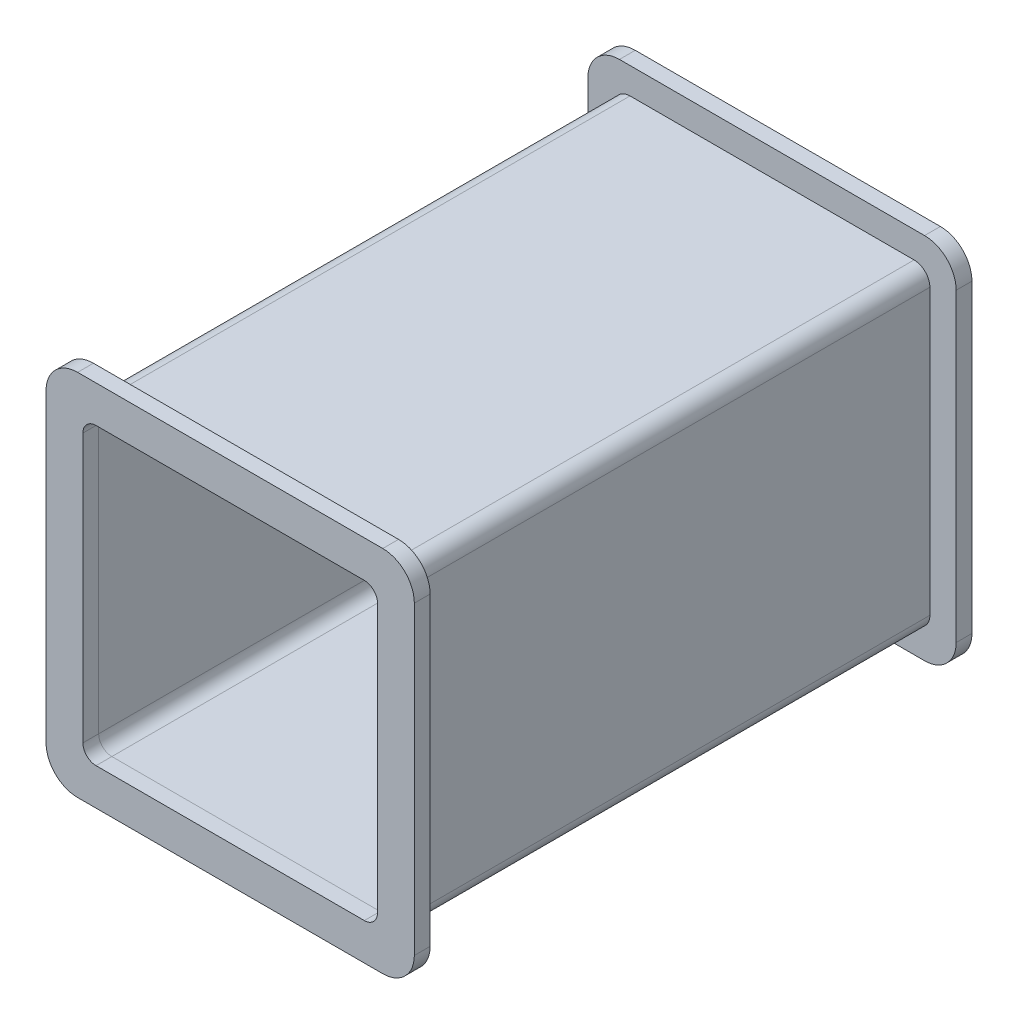
from build123d import *

# Parameters (mm, degrees)
BOSS_EXTRUDE1_DEPTH = 3
BOSS_EXTRUDE2_DEPTH = 100
BOSS_EXTRUDE3_DEPTH = 3


with BuildPart() as part:
    # Sketch1 → Boss-Extrude1 (new body)
    with BuildSketch(Plane(origin=(0, 0, 0), x_dir=(0, 1, 0), z_dir=(0, 0, 1))):
        with BuildLine():
            Line((-1, 63), (57, 63))
            ThreePointArc((57, 63), (61.242640687, 61.242640687), (63, 57))
            Line((63, 57), (63, -1))
            ThreePointArc((63, -1), (61.242640687, -5.242640687), (57, -7))
            Line((57, -7), (-1, -7))
            ThreePointArc((-1, -7), (-5.242640687, -5.242640687), (-7, -1))
            Line((-7, -1), (-7, 57))
            ThreePointArc((-7, 57), (-5.242640687, 61.242640687), (-1, 63))
        make_face()
    extrude(amount=-BOSS_EXTRUDE1_DEPTH)

    # Sketch2 → Boss-Extrude2 (add)
    with BuildSketch(Plane.XY):
        with BuildLine():
            Line((-54.993031309, 57.991494042), (-0.993031309, 57.991494042))
            ThreePointArc((-0.993031309, 57.991494042), (1.128289034, 57.112814386), (2.006968691, 54.991494042))
            Line((2.006968691, 54.991494042), (2.006968691, 0.991494042))
            ThreePointArc((2.006968691, 0.991494042), (1.128289034, -1.129826302), (-0.993031309, -2.008505958))
            Line((-0.993031309, -2.008505958), (-54.993031309, -2.008505958))
            ThreePointArc((-54.993031309, -2.008505958), (-57.114351653, -1.129826302), (-57.993031309, 0.991494042))
            Line((-57.993031309, 0.991494042), (-57.993031309, 54.991494042))
            ThreePointArc((-57.993031309, 54.991494042), (-57.114351653, 57.112814386), (-54.993031309, 57.991494042))
        make_face()
        with BuildLine():
            Line((-55.993031309, 2.491494042), (-55.993031309, 53.491494042))
            ThreePointArc((-55.993031309, 53.491494042), (-55.260798262, 55.259260995), (-53.493031309, 55.991494042))
            Line((-53.493031309, 55.991494042), (-2.493031309, 55.991494042))
            ThreePointArc((-2.493031309, 55.991494042), (-0.725264356, 55.259260995), (0.006968691, 53.491494042))
            Line((0.006968691, 53.491494042), (0.006968691, 2.491494042))
            ThreePointArc((0.006968691, 2.491494042), (-0.725264356, 0.723727089), (-2.493031309, -0.008505958))
            Line((-2.493031309, -0.008505958), (-53.493031309, -0.008505958))
            ThreePointArc((-53.493031309, -0.008505958), (-55.260798262, 0.723727089), (-55.993031309, 2.491494042))
        make_face(mode=Mode.SUBTRACT)
    extrude(amount=BOSS_EXTRUDE2_DEPTH)

    # Sketch4 → Boss-Extrude3 (add)
    with BuildSketch(Plane.XY.offset(100)):
        with BuildLine():
            Line((-56.993104306, 62.991512558), (1.006895694, 62.991512558))
            ThreePointArc((1.006895694, 62.991512558), (5.249536381, 61.234153245), (7.006895694, 56.991512558))
            Line((7.006895694, 56.991512558), (7.006895694, -1.008487442))
            ThreePointArc((7.006895694, -1.008487442), (5.249536381, -5.251128129), (1.006895694, -7.008487442))
            Line((1.006895694, -7.008487442), (-56.993104306, -7.008487442))
            ThreePointArc((-56.993104306, -7.008487442), (-61.235744993, -5.251128129), (-62.993104306, -1.008487442))
            Line((-62.993104306, -1.008487442), (-62.993104306, 56.991512558))
            ThreePointArc((-62.993104306, 56.991512558), (-61.235744993, 61.234153245), (-56.993104306, 62.991512558))
        make_face()
        with BuildLine():
            Line((-55.993104306, 2.491512558), (-55.993104306, 53.491512558))
            ThreePointArc((-55.993104306, 53.491512558), (-55.260871259, 55.259279511), (-53.493104306, 55.991512558))
            Line((-53.493104306, 55.991512558), (-2.493104306, 55.991512558))
            ThreePointArc((-2.493104306, 55.991512558), (-0.725337353, 55.259279511), (0.006895694, 53.491512558))
            Line((0.006895694, 53.491512558), (0.006895694, 2.491512558))
            ThreePointArc((0.006895694, 2.491512558), (-0.725337353, 0.723745605), (-2.493104306, -0.008487442))
            Line((-2.493104306, -0.008487442), (-53.493104306, -0.008487442))
            ThreePointArc((-53.493104306, -0.008487442), (-55.260871259, 0.723745605), (-55.993104306, 2.491512558))
        make_face(mode=Mode.SUBTRACT)
    extrude(amount=BOSS_EXTRUDE3_DEPTH)


solid = part.part
